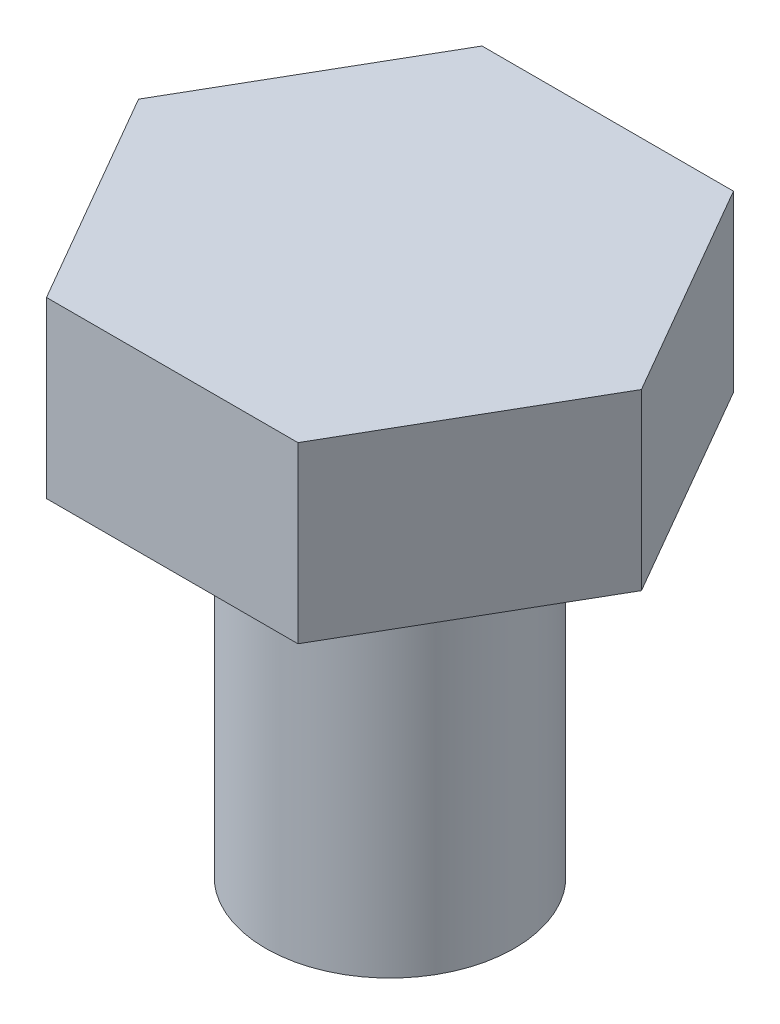
from build123d import *

# Parameters (mm, degrees)
ESQUISSE1_R        = 2
BOSS_EXTRU_1_DEPTH = 6
BOSS_EXTRU_2_DEPTH = 2.8


with BuildPart() as part:
    # Esquisse1 → Boss.-Extru.1 (new body)
    with BuildSketch(Plane(origin=(0, 0, 0), x_dir=(1, 0, 0), z_dir=(0, 1, 0))):
        with Locations(Location((0, 0, 0), (0, 0, 270))):
            Circle(ESQUISSE1_R)
    extrude(amount=-BOSS_EXTRU_1_DEPTH)

    # Esquisse2 → Boss.-Extru.2 (add)
    with BuildSketch(Plane(origin=(0, 0, 0), x_dir=(1, 0, 0), z_dir=(0, 1, 0))):
        Polygon((-4.041451884, 0), (-2.020725942, -3.5), (2.020725942, -3.5), (4.041451884, 0), (2.020725942, 3.5), (-2.020725942, 3.5), align=None)
    extrude(amount=BOSS_EXTRU_2_DEPTH)


solid = part.part
